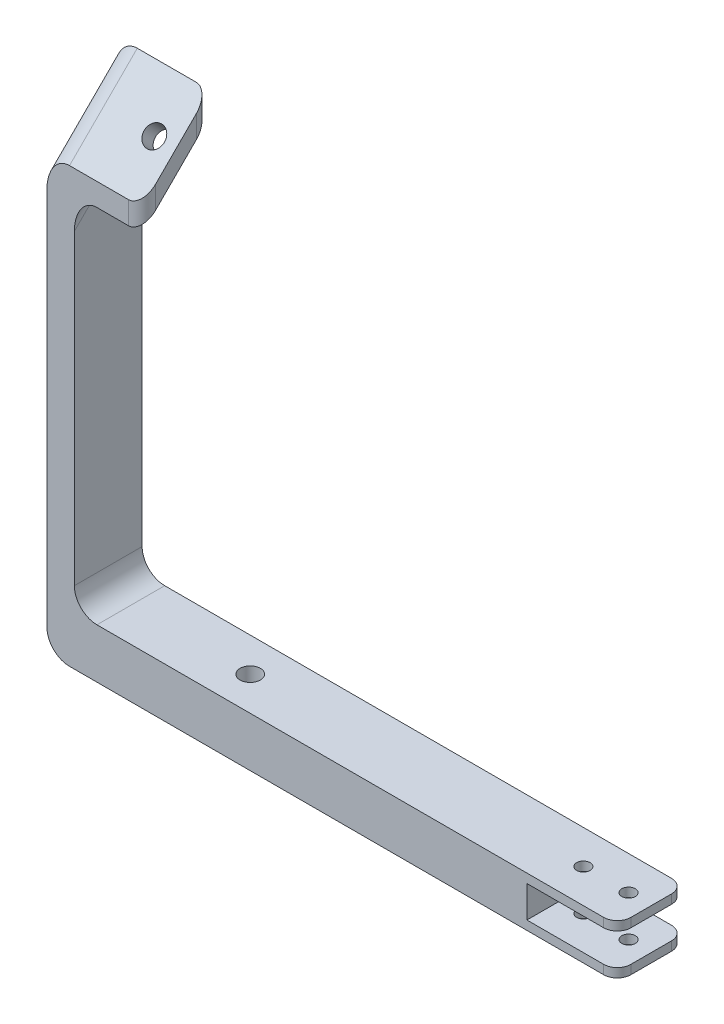
from build123d import *

# Parameters (mm, degrees)
SALIENTE_EXTRUIR1_DEPTH = 7.5
CROQUIS2_R              = 1.5
CORTAR_EXTRUIR1_DEPTH   = 147.100350787
REDONDEO1_R             = 3
REDONDEO2_R             = 3
CORTAR_EXTRUIR3_DEPTH   = 161.092886788
CROQUIS5_R              = 2.25
CORTAR_EXTRUIR4_DEPTH   = 133.941951618
CORTAR_EXTRUIR5_DEPTH   = 161.092886788
CROQUIS7_R              = 2.25
CORTAR_EXTRUIR6_DEPTH   = 7
REDONDEO3_R             = 5


with BuildPart() as part:
    # Croquis1 → Saliente-Extruir1 (new, symmetric)
    with BuildSketch(Plane.XY):
        Polygon((0, -3.5), (0, 3.5), (20, 3.5), (20, 5.5), (-100.18, 5.5), (-100.18, 85.5), (-85.18, 85.5), (-85.18, 105.5), (-106.25, 105.5), (-106.25, -5.5), (20, -5.5), (20, -3.5), align=None)
    extrude(amount=SALIENTE_EXTRUIR1_DEPTH, both=True)

    # Croquis2 → Cortar-Extruir1 (cut, through all)
    with BuildSketch(Plane(origin=(0, 5.5, 0), x_dir=(1, 0, 0), z_dir=(0, 1, 0))):
        with Locations(Location((15, 0, 0), (0, 0, 180))):
            Circle(CROQUIS2_R)
        with Locations(Location((5, 0, 0), (0, 0, 180))):
            Circle(CROQUIS2_R)
    extrude(amount=-CORTAR_EXTRUIR1_DEPTH, mode=Mode.SUBTRACT)

    # Redondeo1
    redondeo1_edges = [part.edges().sort_by_distance(p)[0] for p in [
        (20, -4.5, -7.5),
        (20, 4.5, -7.5),
        (20, 4.5, 7.5),
        (20, -4.5, 7.5),
    ]]
    fillet(redondeo1_edges, radius=REDONDEO1_R)

    # Redondeo2
    redondeo2_edges = [part.edges().sort_by_distance(p)[0] for p in [
        (-85.18, 95.5, -7.5),
        (-85.18, 95.5, 7.5),
    ]]
    fillet(redondeo2_edges, radius=REDONDEO2_R)

    # Croquis4 → Cortar-Extruir3 (cut, through all)
    with BuildSketch(Plane(origin=(-100.18, 0, 0), x_dir=(0, 0, -1), z_dir=(1, 0, 0))):
        Polygon((-7.5, 90.5), (7.5, 105.5), (-7.5, 105.5), align=None)
        Polygon((-7.5, 85.5), (7.5, 100.5), (7.5, 85.5), align=None)
    extrude(amount=CORTAR_EXTRUIR3_DEPTH, mode=Mode.SUBTRACT)

    # Croquis5 → Cortar-Extruir4 (cut, through all)
    with BuildSketch(Plane(origin=(0, 49, 49), x_dir=(1, 0, 0), z_dir=(0, 0.7071067811865464, 0.7071067811865488))):
        with Locations(Location((-89.98, 69.296464556, 0), (0, 0, 270))):
            Circle(CROQUIS5_R)
    extrude(amount=-CORTAR_EXTRUIR4_DEPTH, mode=Mode.SUBTRACT)

    # Croquis6 → Cortar-Extruir5 (cut, through all)
    with BuildSketch(Plane(origin=(-100.18, 0, 0), x_dir=(0, 0, -1), z_dir=(1, 0, 0))):
        Polygon((-7.5, 105.5), (-7.5, 90.5), (7.5, 105.5), align=None)
    extrude(amount=-CORTAR_EXTRUIR5_DEPTH, mode=Mode.SUBTRACT)

    # Croquis7 → Cortar-Extruir6 (cut)
    with BuildSketch(Plane(origin=(0, 5.5, 0), x_dir=(1, 0, 0), z_dir=(0, 1, 0))):
        with Locations(Location((-68.75, 0, 0), (0, 0, 180))):
            Circle(CROQUIS7_R)
    extrude(amount=-CORTAR_EXTRUIR6_DEPTH, mode=Mode.SUBTRACT)

    # Redondeo3
    redondeo3_edges = [part.edges().sort_by_distance(p)[0] for p in [
        (-100.18, 93, 0),
        (-106.25, 98, 0),
        (-106.25, -5.5, 0),
        (-100.18, 5.5, 0),
    ]]
    fillet(redondeo3_edges, radius=REDONDEO3_R)


solid = part.part
